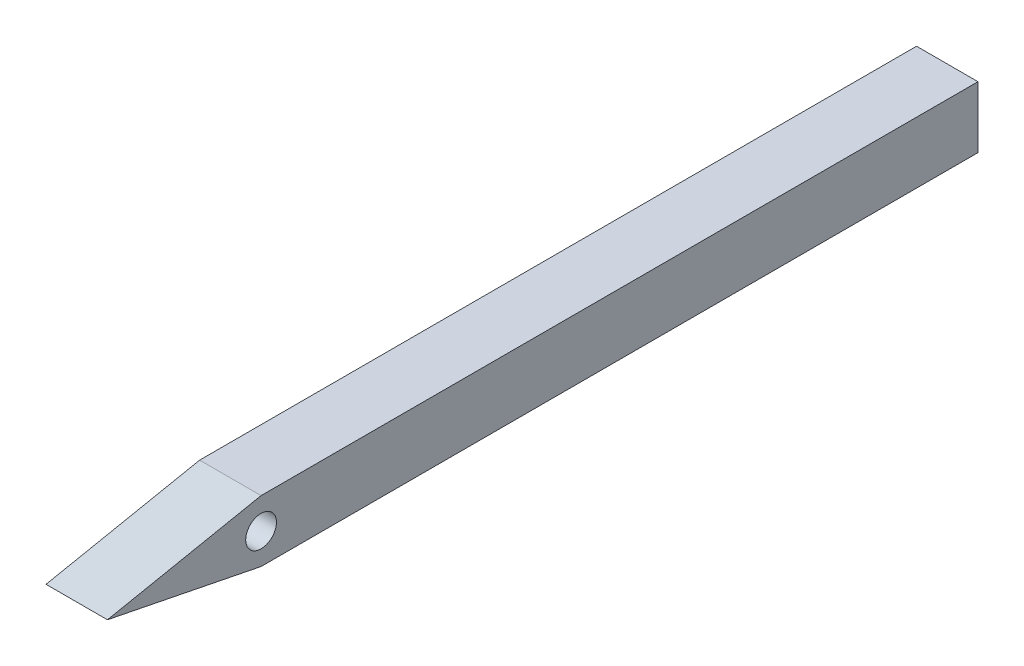
from build123d import *

# Parameters (mm, degrees)
BOSS_EXTRUDE1_DEPTH = 6
SKETCH2_R           = 1.5
CUT_EXTRUDE1_DEPTH  = 6


with BuildPart() as part:
    # Sketch1 → Boss-Extrude1 (new body)
    with BuildSketch(Plane(origin=(0, 0, 0), x_dir=(0, 0, -1), z_dir=(1, 0, 0))):
        Polygon((0, 0), (-70, 0), (-85, 3), (-70, 6), (0, 6), align=None)
    extrude(amount=BOSS_EXTRUDE1_DEPTH)

    # Sketch2 → Cut-Extrude1 (cut)
    with BuildSketch(Plane(origin=(6, 0, 0), x_dir=(0, 0, -1), z_dir=(1, 0, 0))):
        with Locations((-70, 3)):
            Circle(SKETCH2_R)
    extrude(amount=-CUT_EXTRUDE1_DEPTH, mode=Mode.SUBTRACT)


solid = part.part
